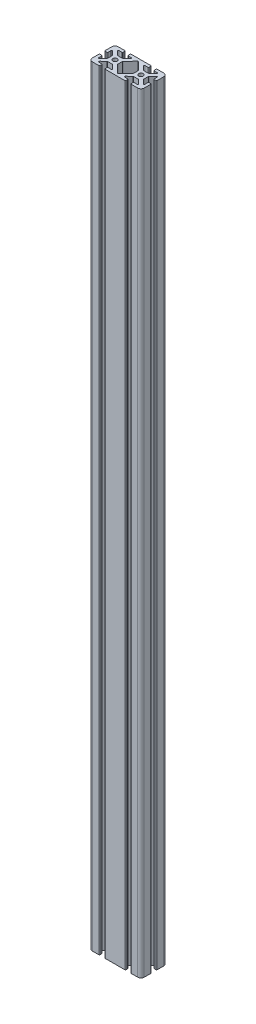
from build123d import *

# Parameters (mm, degrees)
BOSS_EXTRUDE1_DEPTH   = 1185.8
SKETCH3_R             = 3.4
CUT_EXTRUDE1_DEPTH    = 1190.168465778
CUT_EXTRUDE2_DEPTH    = 1190.168465778
FILLET1_R             = 1
FILLET2_R             = 1
FILLET3_R             = 1
CUT_EXTRUDE3_DEPTH    = 1190.168465778
CUT_EXTRUDE4_DEPTH    = 1190.168465778
FILLET4_R             = 1
FILLET5_R             = 1
FILLET6_R             = 1
FILLET7_R             = 1
FILLET8_R             = 1
FILLET9_R             = 1
FILLET10_R            = 1
FILLET11_R            = 1
MIRROR11_COPY_1_DEPTH = 1190.168465778
MIRROR11_COPY_2_DEPTH = 1190.168465778
CUT_EXTRUDE5_DEPTH    = 1190.168465778


with BuildPart() as part:
    # Sketch1 → Boss-Extrude1 (new body)
    with BuildSketch(Plane(origin=(0, 0, 0), x_dir=(1, 0, 0), z_dir=(0, 1, 0))):
        with BuildLine():
            Line((5, 0), (75, 0))
            ThreePointArc((75, 0), (78.535533906, -1.464466094), (80, -5))
            Line((80, -5), (80, -35))
            ThreePointArc((80, -35), (78.535533906, -38.535533906), (75, -40))
            Line((75, -40), (5, -40))
            ThreePointArc((5, -40), (1.464466094, -38.535533906), (0, -35))
            Line((0, -35), (0, -5))
            ThreePointArc((0, -5), (1.464466094, -1.464466094), (5, 0))
        make_face()
    extrude(amount=BOSS_EXTRUDE1_DEPTH)

    # Sketch3 → Cut-Extrude1 (cut, through all)
    with BuildSketch(Plane(origin=(0, 1185.8, 0), x_dir=(1, 0, 0), z_dir=(0, 1, 0))):
        with Locations(Location((20, -20, 0), (0, 0, 270))):
            Circle(SKETCH3_R)
    cut_extrude1 = extrude(amount=-CUT_EXTRUDE1_DEPTH, mode=Mode.SUBTRACT)

    # Mirror3: Cut-Extrude1 across plane
    add(cut_extrude1.mirror(Plane(origin=(40, 0, 0), x_dir=(0, 0, 1), z_dir=(1, 0, 0))), mode=Mode.SUBTRACT)

    # Sketch7 → Cut-Extrude2 (cut, through all)
    with BuildSketch(Plane(origin=(0, 0, 0), x_dir=(-1, 0, 0), z_dir=(0, -1, 0))):
        with BuildLine():
            Line((-15.9, -40), (-24.1, -40))
            Line((-24.1, -40), (-24.1, -36.5))
            ThreePointArc((-24.1, -36.5), (-24.392893219, -35.792893219), (-25.1, -35.5))
            Line((-25.1, -35.5), (-29.489753594, -35.5))
            ThreePointArc((-29.489753594, -35.5), (-30.415270825, -34.8787055), (-30.190750526, -33.786835712))
            Line((-30.190750526, -33.786835712), (-24.391814382, -28.086835712))
            ThreePointArc((-24.391814382, -28.086835712), (-24.069522951, -27.874482769), (-23.69081745, -27.8))
            Line((-23.69081745, -27.8), (-16.309186536, -27.8))
            ThreePointArc((-16.309186536, -27.8), (-15.930477876, -27.874484063), (-15.608184734, -28.086840499))
            Line((-15.608184734, -28.086840499), (-9.809327805, -33.786840499))
            ThreePointArc((-9.809327805, -33.786840499), (-9.584813669, -34.87870866), (-10.510329607, -35.5))
            Line((-10.510329607, -35.5), (-14.9, -35.5))
            ThreePointArc((-14.9, -35.5), (-15.607106781, -35.792893219), (-15.9, -36.5))
            Line((-15.9, -36.5), (-15.9, -40))
        make_face()
    cut_extrude2 = extrude(amount=-CUT_EXTRUDE2_DEPTH, mode=Mode.SUBTRACT)

    # Fillet1
    fillet1_edges = [part.edges().sort_by_distance(p)[0] for p in [
        (15.9, 592.9, 40),
        (24.1, 592.9, 40),
    ]]
    fillet(fillet1_edges, radius=FILLET1_R)

    # Mirror8: Cut-Extrude2 across plane
    add(cut_extrude2.mirror(Plane(origin=(40, 0, 0), x_dir=(0, 0, 1), z_dir=(1, 0, 0))), mode=Mode.SUBTRACT)

    # Fillet2
    fillet2_edges = [part.edges().sort_by_distance(p)[0] for p in [
        (55.9, 592.9, 40),
    ]]
    fillet(fillet2_edges, radius=FILLET2_R)

    # Fillet3
    fillet3_edges = [part.edges().sort_by_distance(p)[0] for p in [
        (64.1, 592.9, 40),
    ]]
    fillet(fillet3_edges, radius=FILLET3_R)

    # Sketch9 → Cut-Extrude3 (cut, through all)
    with BuildSketch(Plane(origin=(0, 0, 0), x_dir=(1, 0, 0), z_dir=(0, 1, 0))):
        with BuildLine():
            Line((14.899846923, -4.500713815), (10.450461284, -4.500713815))
            ThreePointArc((10.450461284, -4.500713815), (9.526581751, -5.118030383), (9.743354502, -6.207820596))
            Line((9.743354502, -6.207820596), (15.442640687, -11.907106781))
            ThreePointArc((15.442640687, -11.907106781), (15.767064036, -12.123879533), (16.149747468, -12.2))
            Line((16.149747468, -12.2), (23.850252532, -12.2))
            ThreePointArc((23.850252532, -12.2), (24.232935964, -12.123879533), (24.557359313, -11.907106781))
            Line((24.557359313, -11.907106781), (30.257359313, -6.207106781))
            ThreePointArc((30.257359313, -6.207106781), (30.474132064, -5.117316568), (29.550252532, -4.5))
            Line((29.550252532, -4.5), (25.099846964, -4.5))
            ThreePointArc((25.099846964, -4.5), (24.392724723, -4.207091321), (24.099846965, -3.499956273))
            Line((24.099846965, -3.499956273), (24.100000008, 0))
            Line((24.100000008, 0), (15.9, 0))
            Line((15.9, 0), (15.899846922, -3.500757542))
            ThreePointArc((15.899846922, -3.500757542), (15.606938244, -4.207836056), (14.899846923, -4.500713815))
        make_face()
    cut_extrude3 = extrude(amount=CUT_EXTRUDE3_DEPTH, mode=Mode.SUBTRACT)

    # Mirror9: Cut-Extrude3 across plane
    add(cut_extrude3.mirror(Plane(origin=(40, 0, 0), x_dir=(0, 0, 1), z_dir=(1, 0, 0))), mode=Mode.SUBTRACT)

    # Sketch10 → Cut-Extrude4 (cut, through all)
    with BuildSketch(Plane(origin=(0, 0, 0), x_dir=(1, 0, 0), z_dir=(0, 1, 0))):
        with BuildLine():
            Line((4.5, -14.9), (4.5, -10.58605332))
            ThreePointArc((4.5, -10.58605332), (5.126159695, -9.658560233), (6.220486853, -9.892584724))
            Line((6.220486853, -9.892584724), (11.920486853, -15.814662646))
            ThreePointArc((11.920486853, -15.814662646), (12.127493087, -16.134290938), (12.2, -16.508131242))
            Line((12.2, -16.508131242), (12.2, -23.491868758))
            ThreePointArc((12.2, -23.491868758), (12.127493087, -23.865709062), (11.920486853, -24.185337354))
            Line((11.920486853, -24.185337354), (6.220486853, -30.107415276))
            ThreePointArc((6.220486853, -30.107415276), (5.126159695, -30.341439767), (4.5, -29.41394668))
            Line((4.5, -29.41394668), (4.5, -25.1))
            ThreePointArc((4.5, -25.1), (4.207106781, -24.392893219), (3.5, -24.1))
            Line((3.5, -24.1), (0, -24.1))
            Line((0, -24.1), (0, -15.9))
            Line((0, -15.9), (3.5, -15.9))
            ThreePointArc((3.5, -15.9), (4.207106781, -15.607106781), (4.5, -14.9))
        make_face()
    cut_extrude4 = extrude(amount=CUT_EXTRUDE4_DEPTH, mode=Mode.SUBTRACT)

    # Fillet4
    fillet4_edges = [part.edges().sort_by_distance(p)[0] for p in [
        (24.100000008, 592.9, 0),
    ]]
    fillet(fillet4_edges, radius=FILLET4_R)

    # Fillet5
    fillet5_edges = [part.edges().sort_by_distance(p)[0] for p in [
        (64.1, 592.9, 0),
    ]]
    fillet(fillet5_edges, radius=FILLET5_R)

    # Fillet6
    fillet6_edges = [part.edges().sort_by_distance(p)[0] for p in [
        (55.899999992, 592.9, 0),
    ]]
    fillet(fillet6_edges, radius=FILLET6_R)

    # Fillet7
    fillet7_edges = [part.edges().sort_by_distance(p)[0] for p in [
        (15.9, 592.9, 0),
    ]]
    fillet(fillet7_edges, radius=FILLET7_R)

    # Fillet8
    fillet8_edges = [part.edges().sort_by_distance(p)[0] for p in [
        (0, 592.9, 24.1),
    ]]
    fillet(fillet8_edges, radius=FILLET8_R)

    # Fillet9
    fillet9_edges = [part.edges().sort_by_distance(p)[0] for p in [
        (0, 592.9, 15.9),
    ]]
    fillet(fillet9_edges, radius=FILLET9_R)

    # Mirror10: Cut-Extrude4 across plane
    add(cut_extrude4.mirror(Plane(origin=(40, 0, 0), x_dir=(0, 0, 1), z_dir=(1, 0, 0))), mode=Mode.SUBTRACT)

    # Fillet10
    fillet10_edges = [part.edges().sort_by_distance(p)[0] for p in [
        (80, 592.9, 15.9),
    ]]
    fillet(fillet10_edges, radius=FILLET10_R)

    # Fillet11
    fillet11_edges = [part.edges().sort_by_distance(p)[0] for p in [
        (80, 592.9, 24.1),
    ]]
    fillet(fillet11_edges, radius=FILLET11_R)

    # Mirror11 copy 1 sketch → Mirror11 copy 1 (cut, through all)
    with BuildSketch(Plane(origin=(40, 0, 0), x_dir=(1, 0, 0), z_dir=(0, 1, 0))):
        with BuildLine():
            Line((4.5, -14.9), (4.5, -10.58605332))
            ThreePointArc((4.5, -10.58605332), (5.126159695, -9.658560233), (6.220486853, -9.892584724))
            Line((6.220486853, -9.892584724), (11.920486853, -15.814662646))
            ThreePointArc((11.920486853, -15.814662646), (12.127493087, -16.134290938), (12.2, -16.508131242))
            Line((12.2, -16.508131242), (12.2, -23.491868758))
            ThreePointArc((12.2, -23.491868758), (12.127493087, -23.865709062), (11.920486853, -24.185337354))
            Line((11.920486853, -24.185337354), (6.220486853, -30.107415276))
            ThreePointArc((6.220486853, -30.107415276), (5.126159695, -30.341439767), (4.5, -29.41394668))
            Line((4.5, -29.41394668), (4.5, -25.1))
            ThreePointArc((4.5, -25.1), (4.207106781, -24.392893219), (3.5, -24.1))
            Line((3.5, -24.1), (0, -24.1))
            Line((0, -24.1), (0, -15.9))
            Line((0, -15.9), (3.5, -15.9))
            ThreePointArc((3.5, -15.9), (4.207106781, -15.607106781), (4.5, -14.9))
        make_face()
    extrude(amount=MIRROR11_COPY_1_DEPTH, mode=Mode.SUBTRACT)

    # Mirror11 copy 2 sketch → Mirror11 copy 2 (cut, through all)
    with BuildSketch(Plane(origin=(120, 0, 0), x_dir=(-1, 0, 0), z_dir=(0, 1, 0))):
        with BuildLine():
            Line((4.5, 14.9), (4.5, 10.58605332))
            ThreePointArc((4.5, 10.58605332), (5.126159695, 9.658560233), (6.220486853, 9.892584724))
            Line((6.220486853, 9.892584724), (11.920486853, 15.814662646))
            ThreePointArc((11.920486853, 15.814662646), (12.127493087, 16.134290938), (12.2, 16.508131242))
            Line((12.2, 16.508131242), (12.2, 23.491868758))
            ThreePointArc((12.2, 23.491868758), (12.127493087, 23.865709062), (11.920486853, 24.185337354))
            Line((11.920486853, 24.185337354), (6.220486853, 30.107415276))
            ThreePointArc((6.220486853, 30.107415276), (5.126159695, 30.341439767), (4.5, 29.41394668))
            Line((4.5, 29.41394668), (4.5, 25.1))
            ThreePointArc((4.5, 25.1), (4.207106781, 24.392893219), (3.5, 24.1))
            Line((3.5, 24.1), (0, 24.1))
            Line((0, 24.1), (0, 15.9))
            Line((0, 15.9), (3.5, 15.9))
            ThreePointArc((3.5, 15.9), (4.207106781, 15.607106781), (4.5, 14.9))
        make_face()
    extrude(amount=MIRROR11_COPY_2_DEPTH, mode=Mode.SUBTRACT)

    # Mirror12: Cut-Extrude4 across plane
    add(cut_extrude4.mirror(Plane.ZY.offset(-20)), mode=Mode.SUBTRACT)

    # Sketch12 → Cut-Extrude5 (cut, through all)
    with BuildSketch(Plane(origin=(0, 0, 0), x_dir=(-1, 0, 0), z_dir=(0, -1, 0))):
        with BuildLine():
            Line((-28.079513147, -24.185337354), (-39.327067998, -35.871108628))
            ThreePointArc((-39.327067998, -35.871108628), (-40.049082116, -36.177638866), (-40.770156561, -35.868904648))
            Line((-40.770156561, -35.868904648), (-51.922601709, -24.210885791))
            ThreePointArc((-51.922601709, -24.210885791), (-52.128062958, -23.892044517), (-52.2, -23.519621175))
            Line((-52.2, -23.519621175), (-52.2, -16.508131242))
            ThreePointArc((-52.2, -16.508131242), (-52.127493087, -16.134290938), (-51.920486853, -15.814662646))
            Line((-51.920486853, -15.814662646), (-40.720486853, -4.17829901))
            ThreePointArc((-40.720486853, -4.17829901), (-40, -3.871767606), (-39.279513147, -4.17829901))
            Line((-39.279513147, -4.17829901), (-28.079513147, -15.814662646))
            ThreePointArc((-28.079513147, -15.814662646), (-27.872506913, -16.134290938), (-27.8, -16.508131242))
            Line((-27.8, -16.508131242), (-27.8, -23.491868758))
            ThreePointArc((-27.8, -23.491868758), (-27.872506913, -23.865709062), (-28.079513147, -24.185337354))
        make_face()
    extrude(amount=-CUT_EXTRUDE5_DEPTH, mode=Mode.SUBTRACT)


solid = part.part
